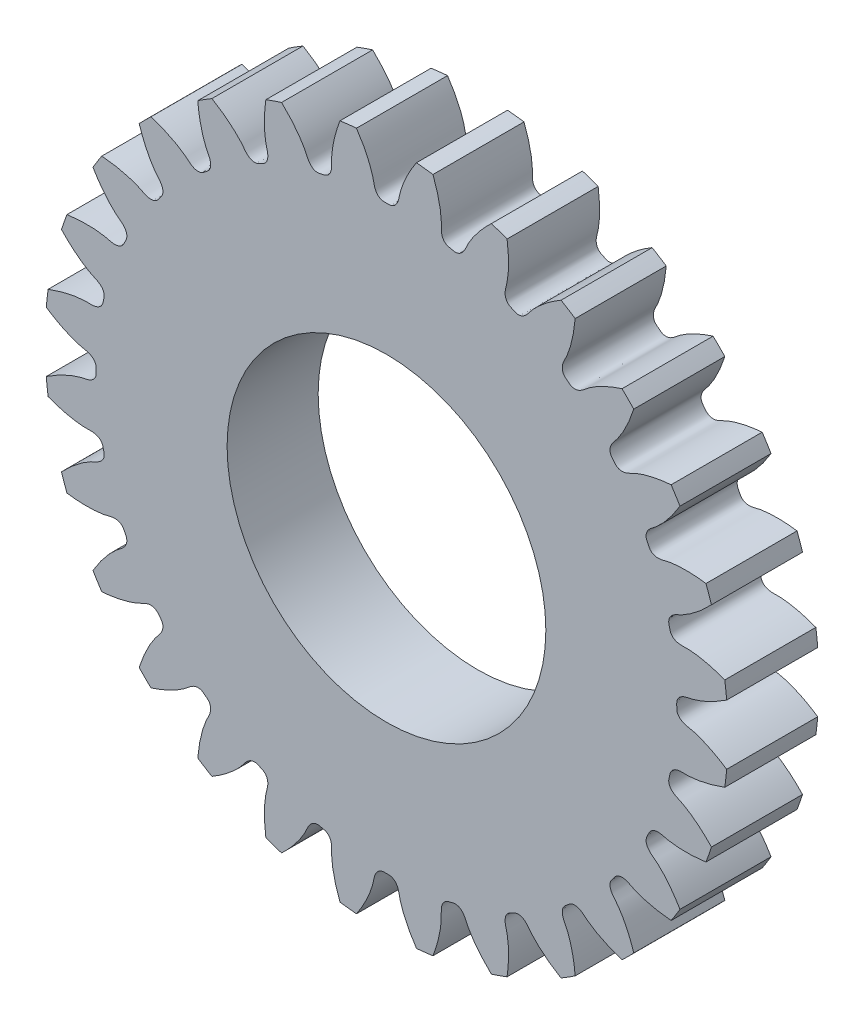
from build123d import *

# Parameters (mm, degrees)
SKETCHREVOLVESPURPINION_W       = 4
SKETCHREVOLVESPURPINION_H       = 14.999999775
TOOTHEXTRUDECUTSPURPINION_DEPTH = 2
PATTERNSPURPINION_COUNT         = 28
BOREREVOLVESKETCH_W             = 4
BOREREVOLVESKETCH_H             = 7


with BuildPart() as part:
    # SketchRevolveSpurPinion → SpurPinion (revolve)
    with BuildSketch(Plane(origin=(0, 0, 0), x_dir=(0, 0, -1), z_dir=(1, 0, 0))):
        with Locations((0, 7.499999888)):
            Rectangle(SKETCHREVOLVESPURPINION_W, SKETCHREVOLVESPURPINION_H)
    revolve(axis=Axis((0, 0, 0), (0, 0, -1)))

    # SketchToothSpurPinion → ToothExtrudeCutSpurPinion (cut, symmetric)
    with BuildSketch(Plane.XY):
        with BuildLine():
            ThreePointArc((14.989536432, 1.347698316), (15.049999774, 0), (14.989536432, -1.347698316))
            add(Edge.make_bspline(
                [(14.989536432, -1.347698316), (14.834143552, -1.242155758), (14.62732743, -1.112863487), (14.367424713, -0.970875025), (14.227258704, -0.899278518), (14.094327664, -0.835964859), (13.968976602, -0.780473907), (13.851530377, -0.732332382), (13.74229312, -0.691055537), (13.641548824, -0.65614685), (13.549557621, -0.627101888), (13.46656622, -0.603399373), (13.392773595, -0.584532666), (13.277102525, -0.558253835), (13.166357443, -0.540992982), (13.064696915, -0.50561432), (13.014593832, -0.484369701), (12.965835511, -0.458783513), (12.917853446, -0.42737669), (12.87042187, -0.387706303), (12.824503256, -0.336364639), (12.783535685, -0.269789953), (12.757049385, -0.191813167), (12.74648267, -0.099590989), (12.752039086, 0), (12.74648267, 0.099590989), (12.757049385, 0.191813167), (12.783535685, 0.269789953), (12.824503256, 0.336364639), (12.87042187, 0.387706303), (12.917853446, 0.42737669), (12.965835511, 0.458783513), (13.014593832, 0.484369701), (13.064696915, 0.50561432), (13.166357443, 0.540992982), (13.277102525, 0.558253835), (13.392773595, 0.584532666), (13.46656622, 0.603399373), (13.549557621, 0.627101888), (13.641548824, 0.65614685), (13.74229312, 0.691055537), (13.851530377, 0.732332382), (13.968976602, 0.780473907), (14.094327664, 0.835964859), (14.227258704, 0.899278518), (14.367424713, 0.970875025), (14.62732743, 1.112863487), (14.834143552, 1.242155758), (14.989536432, 1.347698316)],
                knots=[0, 0, 0, 0, 0.101925901, 0.132230195, 0.160697866, 0.187328912, 0.212123335, 0.235081134, 0.256202309, 0.27548686, 0.292934788, 0.308546091, 0.322320771, 0.334258827, 0.372935144, 0.382829365, 0.392596991, 0.402447171, 0.412670839, 0.423661924, 0.435910203, 0.449896378, 0.465798495, 0.480169576, 0.5, 0.519830424, 0.534201505, 0.550103622, 0.564089797, 0.576338076, 0.587329161, 0.597552829, 0.607403009, 0.617170635, 0.627064856, 0.665741173, 0.677679229, 0.691453909, 0.707065212, 0.72451314, 0.743797691, 0.764918866, 0.787876665, 0.812671088, 0.839302134, 0.867769805, 0.898074099, 1, 1, 1, 1], degree=3))
        make_face()
    toothextrudecutspurpinion = extrude(amount=TOOTHEXTRUDECUTSPURPINION_DEPTH, both=True, mode=Mode.SUBTRACT)

    # PatternSpurPinion: ToothExtrudeCutSpurPinion ×28 about axis
    patternspurpinion_axis = Axis((0, 0, 55), (0, 0, -1))
    for i in range(1, PATTERNSPURPINION_COUNT):
        add(toothextrudecutspurpinion.rotate(patternspurpinion_axis, i * 360 / PATTERNSPURPINION_COUNT), mode=Mode.SUBTRACT)

    # BoreRevolveSketch → BoreRevolveCut (revolve, cut)
    with BuildSketch(Plane(origin=(0, 0, 0), x_dir=(0, 0, -1), z_dir=(1, 0, 0))):
        with Locations((0, 3.5)):
            Rectangle(BOREREVOLVESKETCH_W, BOREREVOLVESKETCH_H)
    revolve(axis=Axis((0, 0, 0), (0, 0, -1)), mode=Mode.SUBTRACT)


solid = part.part
